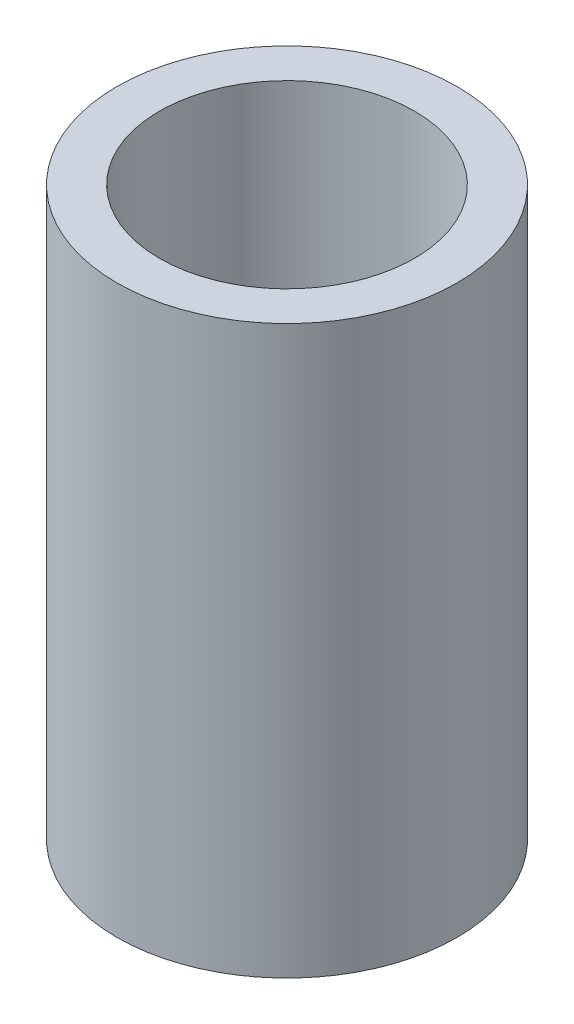
from build123d import *

# Parameters (mm, degrees)
PROFILES_W = 3
PROFILES_H = 40


with BuildPart() as part:
    # ProfileS → Profile (revolve)
    with BuildSketch(Plane.XY):
        with Locations((-10.5, 0)):
            Rectangle(PROFILES_W, PROFILES_H)
    revolve(axis=Axis((0, -20, 0), (0, 1, 0)))


solid = part.part
